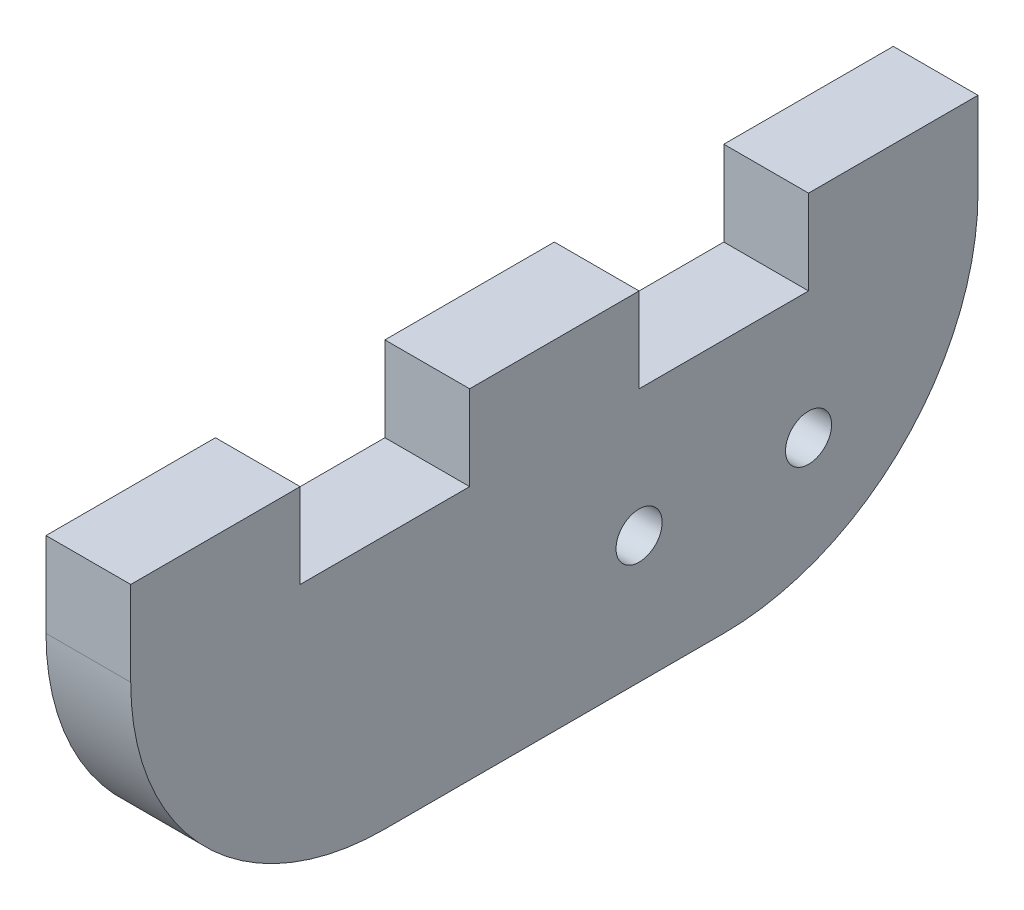
from build123d import *

# Parameters (mm, degrees)
BOSS_EXTRUDE1_DEPTH   = 3.175
F_8_32_TAPPED_HOLE1_D = 3.4544
FILLET1_R             = 19.05


with BuildPart() as part:
    # Sketch1 → Boss-Extrude1 (new, symmetric)
    with BuildSketch(Plane(origin=(0, 0, 0), x_dir=(0, 0, -1), z_dir=(1, 0, 0))):
        Polygon((0, 0), (0, 6.35), (-12.7, 6.35), (-12.7, 0), (-25.4, 0), (-25.4, 6.35), (-38.1, 6.35), (-38.1, 0), (-50.8, 0), (-50.8, 6.35), (-63.5, 6.35), (-63.5, -19.05), (0, -19.05), align=None)
    extrude(amount=BOSS_EXTRUDE1_DEPTH, both=True)

    # #8-32 Tapped Hole1 (through all)
    with Locations(Plane(origin=(3.175, 0, 0), x_dir=(0, 0, -1), z_dir=(1, 0, 0))):
        with Locations((-12.7, -9.525), (-25.4, -9.525)):
            Hole(F_8_32_TAPPED_HOLE1_D / 2)

    # Fillet1
    fillet1_edges = [part.edges().sort_by_distance(p)[0] for p in [
        (0, -19.05, 0),
        (0, -19.05, 63.5),
    ]]
    fillet(fillet1_edges, radius=FILLET1_R)


solid = part.part
